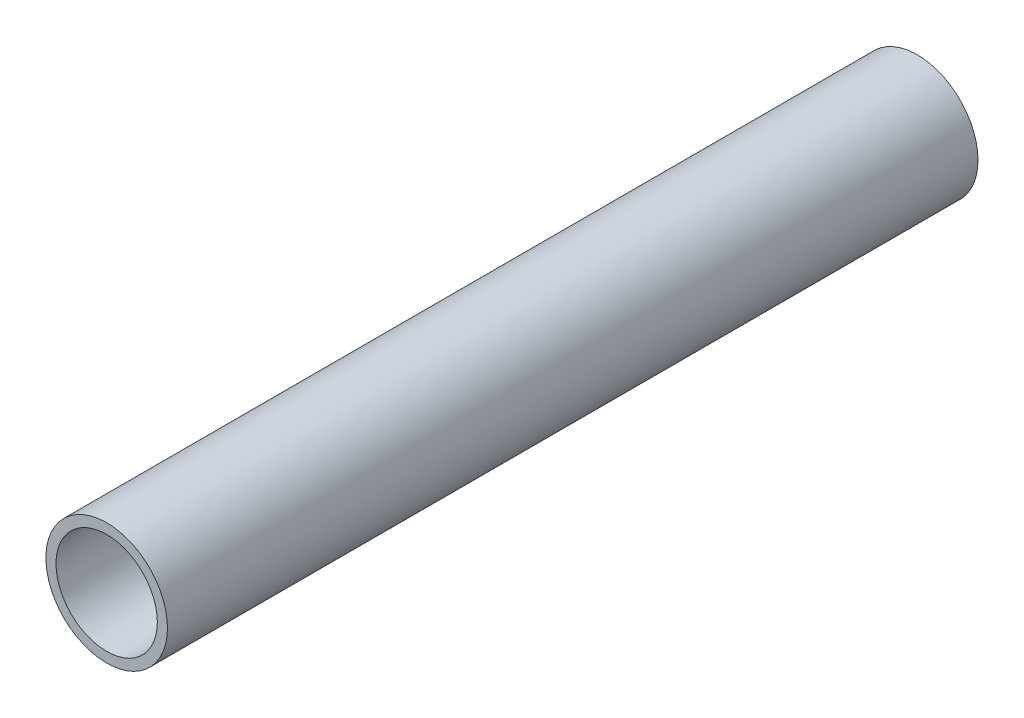
from build123d import *

# Parameters (mm, degrees)
SKETCH1_R           = 15
SKETCH1_R_2         = 12.5
BOSS_EXTRUDE1_DEPTH = 200


with BuildPart() as part:
    # Sketch1 → Boss-Extrude1 (new body)
    with BuildSketch(Plane.XY):
        Circle(SKETCH1_R)
        Circle(SKETCH1_R_2, mode=Mode.SUBTRACT)
    extrude(amount=BOSS_EXTRUDE1_DEPTH)


solid = part.part
